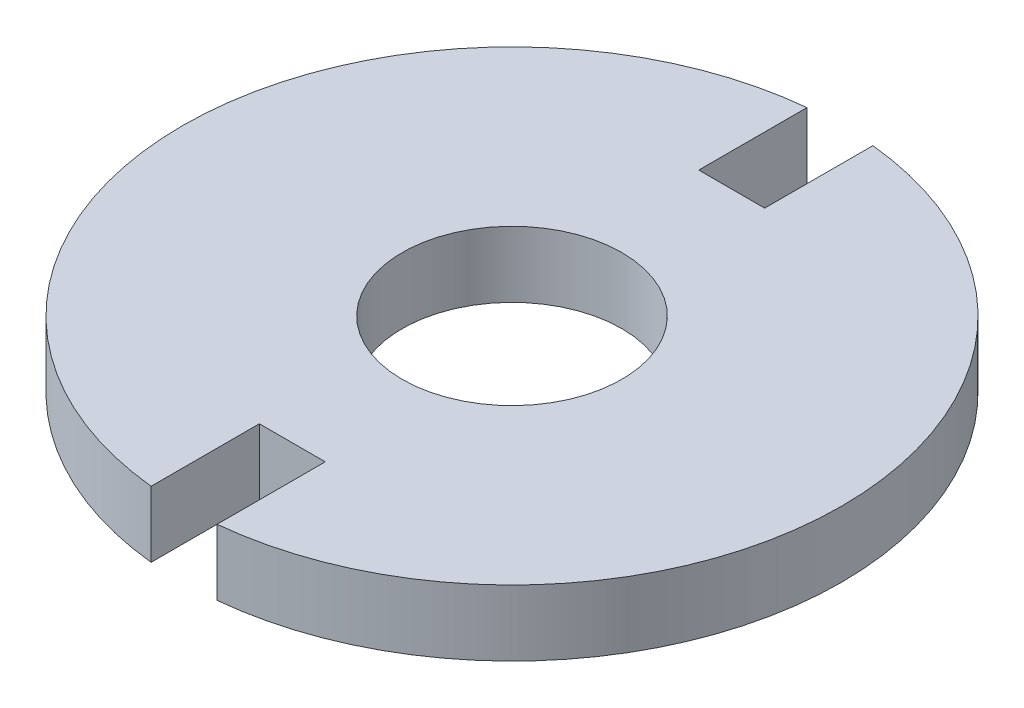
from build123d import *

# Parameters (mm, degrees)
SKETCH_1_R      = 5
EXTRUDE_1_DEPTH = 3


with BuildPart() as part:
    # 草图1 → 凸台-拉伸1 (new body)
    with BuildSketch(Plane(origin=(0, 0, 0), x_dir=(1, 0, 0), z_dir=(0, 1, 0))):
        with BuildLine():
            Line((-1.5, -14.924811557), (-1.5, -10))
            Line((-1.5, -10), (1.5, -10))
            Line((1.5, -10), (1.5, -14.924811557))
            ThreePointArc((1.5, -14.924811557), (15, 0), (1.5, 14.924811557))
            Line((1.5, 14.924811557), (1.5, 10))
            Line((1.5, 10), (-1.5, 10))
            Line((-1.5, 10), (-1.5, 14.924811557))
            ThreePointArc((-1.5, 14.924811557), (-15, 0), (-1.5, -14.924811557))
        make_face()
        with Locations(Location((0, 0, 0), (0, 0, 270))):
            Circle(SKETCH_1_R, mode=Mode.SUBTRACT)
    extrude(amount=EXTRUDE_1_DEPTH)


solid = part.part
